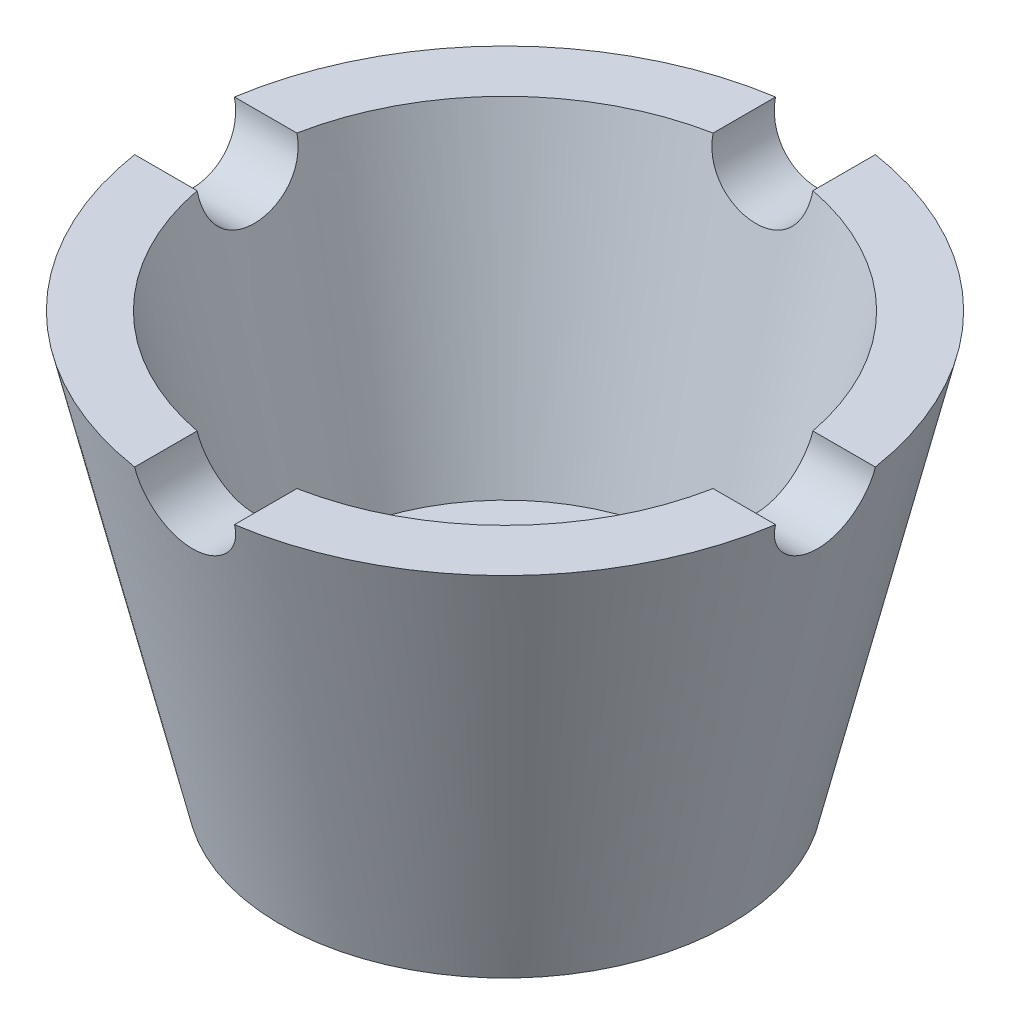
from build123d import *

# Parameters (mm, degrees)
CUT_EXTRUDE1_DEPTH      = 63.261545114
CUT_EXTRUDE1_DEPTH_BACK = 63.261545114
SKETCH3_R               = 5
CUT_EXTRUDE2_DEPTH      = 63.060454569
CUT_EXTRUDE2_DEPTH_BACK = 63.060454569
SKETCH4_R               = 5


with BuildPart() as part:
    # Sketch2 → Revolve1 (revolve)
    with BuildSketch(Plane.XY, mode=Mode.PRIVATE) as revolve1_sk:
        Polygon((11.25, 0), (22.5, 0), (32.5, 42), (26.332276244, 42), (19.189419101, 12), (11.25, 12), align=None)
    revolve(revolve1_sk.sketch.rotate(Axis((0, 0, 0), (0, 1, 0)), 90), axis=Axis((0, 0, 0), (0, 1, 0)))

    # Sketch3 → Cut-Extrude1 (cut, two sides: drawn at the far end of the back side and taken through both)
    with BuildSketch(Plane(origin=(0, 0, 0), x_dir=(0, 0, -1), z_dir=(1, 0, 0)).offset(-CUT_EXTRUDE1_DEPTH_BACK)):
        with Locations((0, 42)):
            Circle(SKETCH3_R)
    extrude(amount=CUT_EXTRUDE1_DEPTH + CUT_EXTRUDE1_DEPTH_BACK, mode=Mode.SUBTRACT)

    # Sketch4 → Cut-Extrude2 (cut, two sides: drawn at the far end of the back side and taken through both)
    with BuildSketch(Plane.XY.offset(-CUT_EXTRUDE2_DEPTH_BACK)):
        with Locations((0, 42)):
            Circle(SKETCH4_R)
    extrude(amount=CUT_EXTRUDE2_DEPTH + CUT_EXTRUDE2_DEPTH_BACK, mode=Mode.SUBTRACT)


solid = part.part
